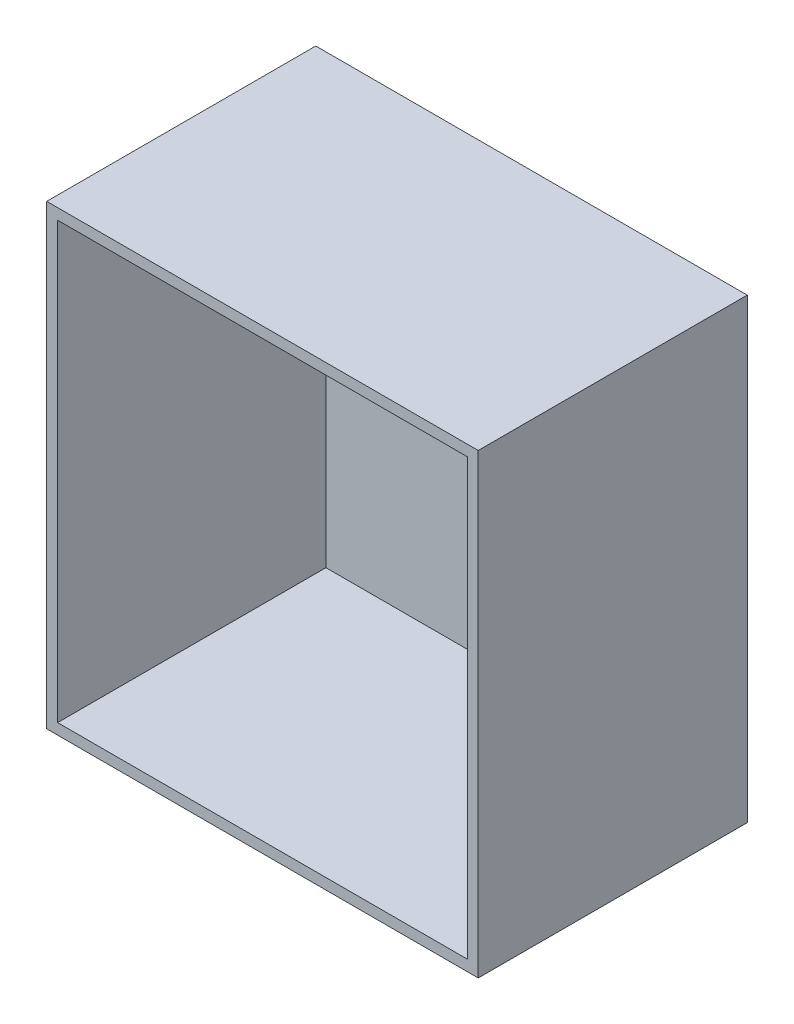
from build123d import *

# Parameters (mm, degrees)
SKETCH1_W           = 595
SKETCH1_H           = 630
SKETCH1_W_2         = 565
SKETCH1_H_2         = 600
BOSS_EXTRUDE3_DEPTH = 370
SKETCH3_W           = 595
SKETCH3_H           = 630
BOSS_EXTRUDE4_DEPTH = 1


with BuildPart() as part:
    # Sketch1 → Boss-Extrude3 (new body)
    with BuildSketch(Plane.XY):
        Rectangle(SKETCH1_W, SKETCH1_H)
        Rectangle(SKETCH1_W_2, SKETCH1_H_2, mode=Mode.SUBTRACT)
    extrude(amount=BOSS_EXTRUDE3_DEPTH)

    # Sketch3 → Boss-Extrude4 (add)
    with BuildSketch(Plane(origin=(0, 0, 0), x_dir=(-1, 0, 0), z_dir=(0, 0, -1))):
        Rectangle(SKETCH3_W, SKETCH3_H)
    extrude(amount=BOSS_EXTRUDE4_DEPTH)


solid = part.part
